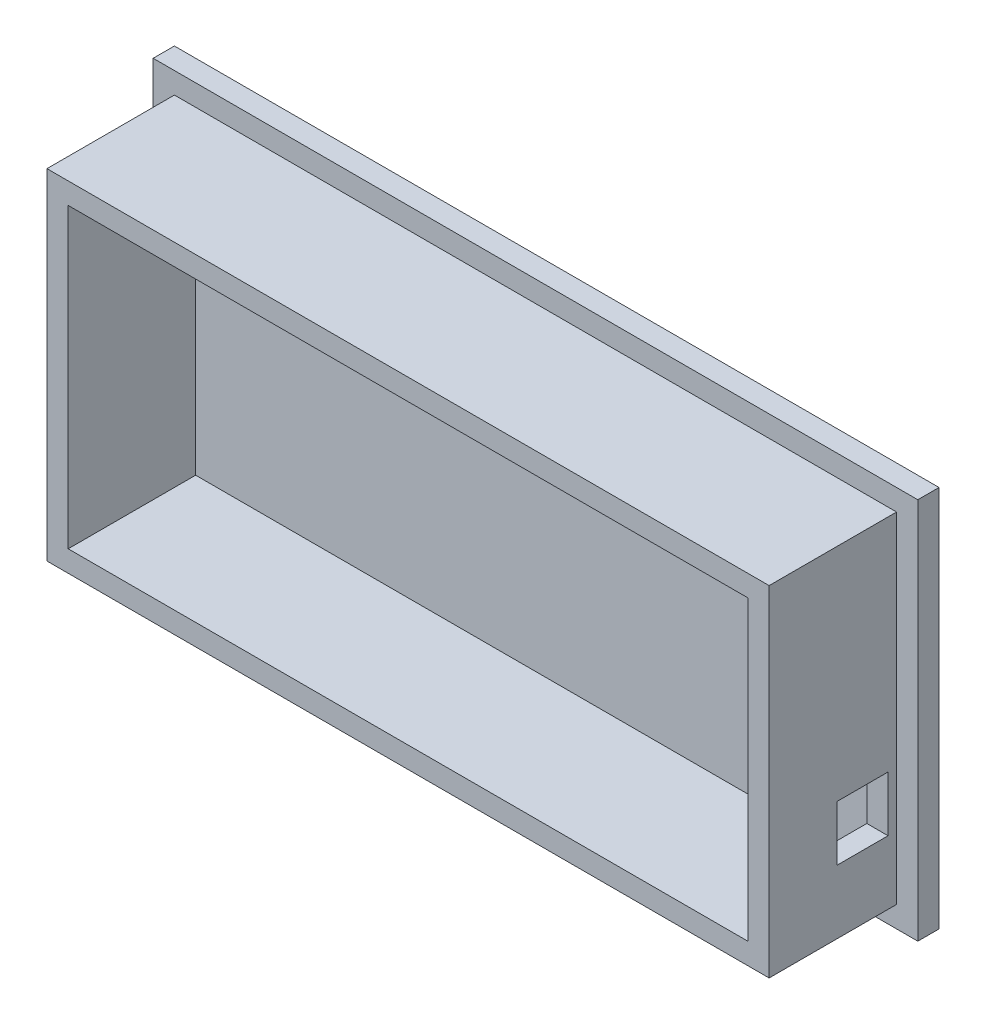
from build123d import *

# Parameters (mm, degrees)
ESQUISSE2_W             = 180
ESQUISSE2_H             = 90
BOSS_EXTRU_2_DEPTH      = 5
ESQUISSE3_W             = 170
ESQUISSE3_H             = 80
ESQUISSE3_W_2           = 160
ESQUISSE3_H_2           = 70
BOSS_EXTRU_3_DEPTH      = 30
ESQUISSE4_W             = 12
ESQUISSE4_H             = 13
ENL_V_MAT_EXTRU_1_DEPTH = 5


with BuildPart() as part:
    # Esquisse2 → Boss.-Extru.2 (new body)
    with BuildSketch(Plane.XY):
        with Locations((90, 45)):
            Rectangle(ESQUISSE2_W, ESQUISSE2_H)
    extrude(amount=BOSS_EXTRU_2_DEPTH)

    # Esquisse3 → Boss.-Extru.3 (add)
    with BuildSketch(Plane.XY.offset(5)):
        with Locations((90, 45)):
            Rectangle(ESQUISSE3_W, ESQUISSE3_H)
        with Locations((90, 45)):
            Rectangle(ESQUISSE3_W_2, ESQUISSE3_H_2, mode=Mode.SUBTRACT)
    extrude(amount=BOSS_EXTRU_3_DEPTH)

    # Esquisse4 → Enlèv. mat.-Extru.1 (cut)
    with BuildSketch(Plane(origin=(175, 0, 0), x_dir=(0, 0, -1), z_dir=(1, 0, 0))):
        with Locations((-13, 26.5)):
            Rectangle(ESQUISSE4_W, ESQUISSE4_H)
    extrude(amount=-ENL_V_MAT_EXTRU_1_DEPTH, mode=Mode.SUBTRACT)


solid = part.part
